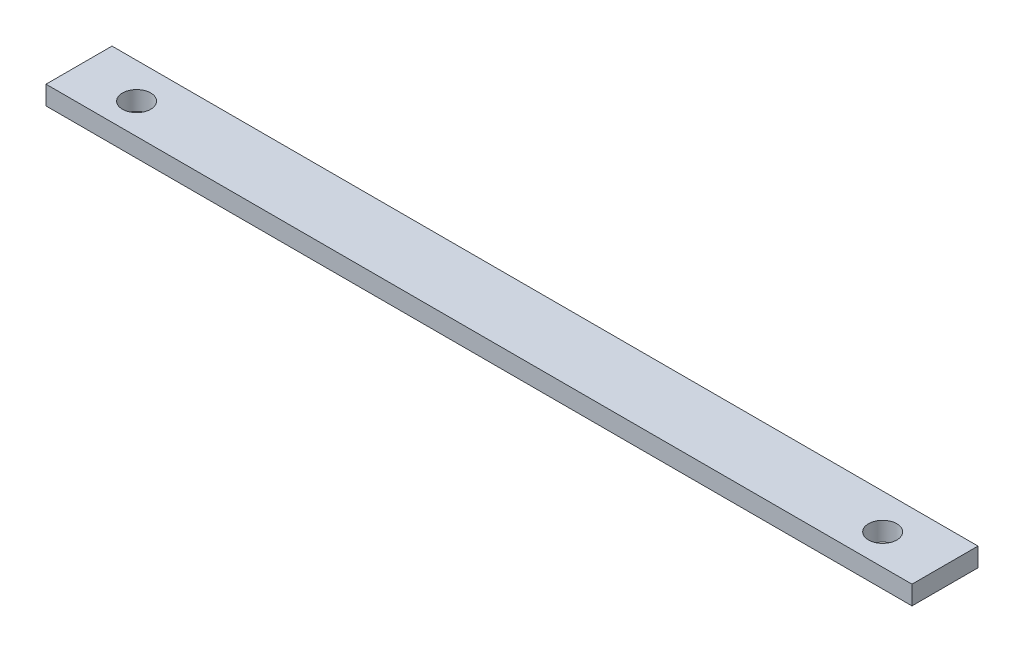
from build123d import *

# Parameters (mm, degrees)
SKETCH1_W           = 183.666666702
SKETCH1_H           = 14
BOSS_EXTRUDE1_DEPTH = 4
SKETCH2_R           = 3
CUT_EXTRUDE1_DEPTH  = 93.186556039


with BuildPart() as part:
    # Sketch1 → Boss-Extrude1 (new body)
    with BuildSketch(Plane(origin=(0, 0, 0), x_dir=(1, 0, 0), z_dir=(0, 1, 0))):
        Rectangle(SKETCH1_W, SKETCH1_H)
    extrude(amount=BOSS_EXTRUDE1_DEPTH)

    # Sketch2 → Cut-Extrude1 (cut, through all)
    with BuildSketch(Plane(origin=(0, 4, 0), x_dir=(1, 0, 0), z_dir=(0, 1, 0))):
        with Locations(Location((79.116666649, -0.5, 0), (0, 0, 270))):
            Circle(SKETCH2_R)
        with Locations(Location((-79.116666649, -0.5, 0), (0, 0, 90))):
            Circle(SKETCH2_R)
    extrude(amount=-CUT_EXTRUDE1_DEPTH, mode=Mode.SUBTRACT)


solid = part.part
